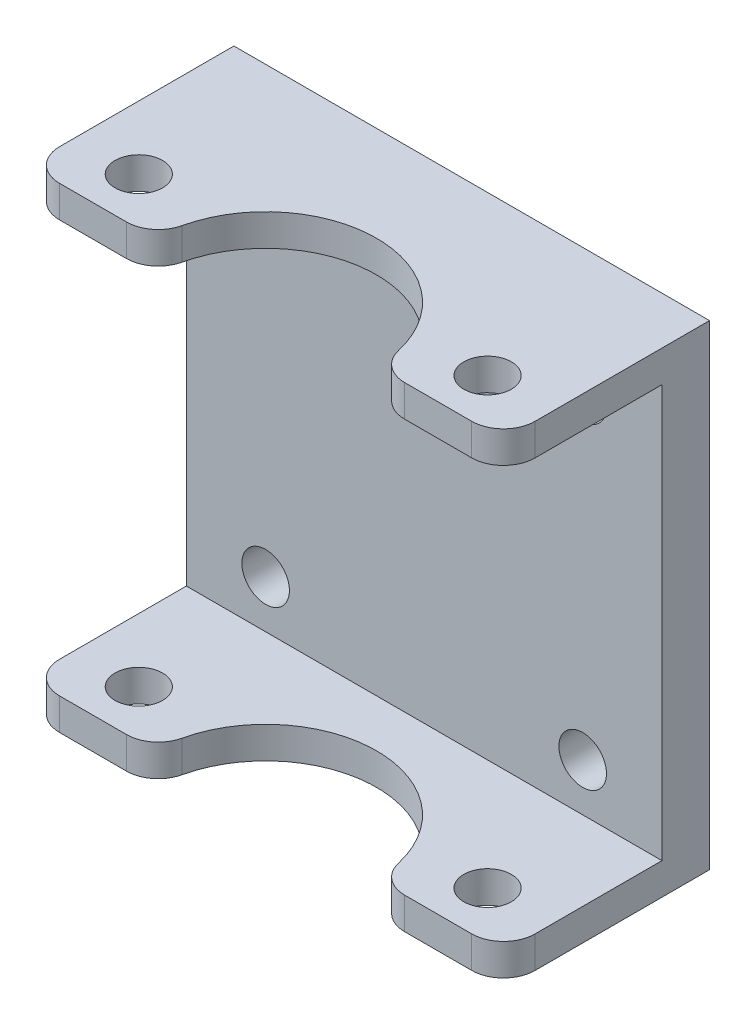
from build123d import *

# Parameters (mm, degrees)
SKETCH_1_W               = 30
SKETCH_1_H               = 30
SKETCH_1_R               = 1.5
EXTRUDE_1_DEPTH          = 3
SKETCH_2_W               = 30
SKETCH_2_H               = 2
EXTRUDE_2_DEPTH          = 18
CUT_EXTRUDE_1_DEPTH      = 39.078865529
CUT_EXTRUDE_1_DEPTH_BACK = 39.078865529
SKETCH_3_R               = 1.5
CUT_EXTRUDE_2_DEPTH      = 40.572717875
FILLET_1_R               = 2


with BuildPart() as part:
    # 草图1 → 凸台-拉伸1 (new body)
    with BuildSketch(Plane.XY):
        Rectangle(SKETCH_1_W, SKETCH_1_H)
        with Locations((-10, 10)):
            Circle(SKETCH_1_R, mode=Mode.SUBTRACT)
        with Locations((10, 10)):
            Circle(SKETCH_1_R, mode=Mode.SUBTRACT)
        with Locations((-10, -10)):
            Circle(SKETCH_1_R, mode=Mode.SUBTRACT)
        with Locations((10, -10)):
            Circle(SKETCH_1_R, mode=Mode.SUBTRACT)
    extrude(amount=EXTRUDE_1_DEPTH)

    # 草图2 → 凸台-拉伸2 (add)
    with BuildSketch(Plane.XY.offset(3)):
        with Locations((0, 14)):
            Rectangle(SKETCH_2_W, SKETCH_2_H)
        with Locations((0, -14)):
            Rectangle(SKETCH_2_W, SKETCH_2_H)
    extrude(amount=EXTRUDE_2_DEPTH)

    # 草图3 → 切除-拉伸1 (cut, two sides: drawn at the far end of the back side and taken through both)
    with BuildSketch(Plane.XZ.offset(-13).offset(-CUT_EXTRUDE_1_DEPTH_BACK)):
        with Locations((-11, 10)):
            Circle(SKETCH_3_R)
        with Locations(Location((11, 10, 0), (0, 0, 270))):
            Circle(SKETCH_3_R)
    extrude(amount=CUT_EXTRUDE_1_DEPTH + CUT_EXTRUDE_1_DEPTH_BACK, mode=Mode.SUBTRACT)

    # 草图4 → 切除-拉伸2 (cut, through all)
    with BuildSketch(Plane.XZ.offset(15)):
        with BuildLine():
            Line((-7, 13), (-16.491106969, 13))
            Line((-16.491106969, 13), (-16.491106969, 22.234658659))
            Line((-16.491106969, 22.234658659), (16.365937277, 22.234658659))
            Line((16.365937277, 22.234658659), (16.365937277, 13))
            Line((16.365937277, 13), (7, 13))
            ThreePointArc((7, 13), (0, 6), (-7, 13))
        make_face()
    extrude(amount=-CUT_EXTRUDE_2_DEPTH, mode=Mode.SUBTRACT)

    # 圆角1
    fillet_1_edges = [part.edges().sort_by_distance(p)[0] for p in [
        (7, 14, 13),
        (7, -14, 13),
        (-15, 14, 13),
        (-7, 14, 13),
        (-15, -14, 13),
        (-7, -14, 13),
        (15, 14, 13),
        (15, -14, 13),
    ]]
    fillet(fillet_1_edges, radius=FILLET_1_R)


solid = part.part
